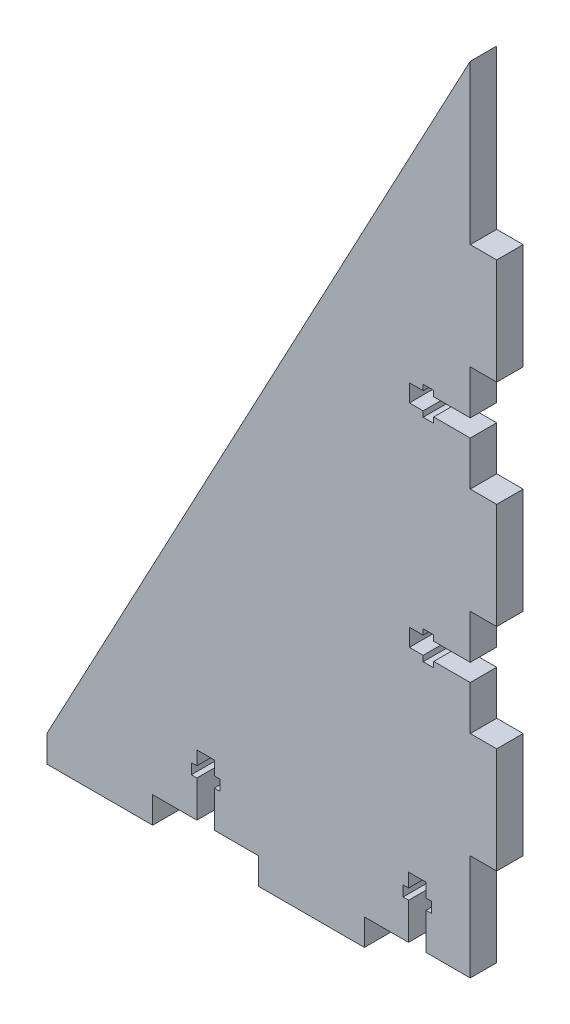
from build123d import *

# Parameters (mm, degrees)
BOSS_EXTRUDE1_DEPTH = 3.175
SKETCH2_W           = 6.35
SKETCH2_H           = 25.4
BOSS_EXTRUDE2_DEPTH = 6.35
LPATTERN1_COUNT     = 3
LPATTERN1_PITCH     = 50.8
SKETCH3_W           = 25.4
SKETCH3_H           = 6.35
BOSS_EXTRUDE3_DEPTH = 6.35
LPATTERN2_COUNT     = 2
LPATTERN2_PITCH     = 50.8
CUT_EXTRUDE1_DEPTH  = 292.166765647


with BuildPart() as part:
    # Sketch1 → Boss-Extrude1 (new, symmetric)
    with BuildSketch(Plane.XY):
        Polygon((49.19007938, 285.75), (49.19007938, 95.25), (-52.40992062, 95.25), align=None)
    extrude(amount=BOSS_EXTRUDE1_DEPTH, both=True)

    # Sketch2 → Boss-Extrude2 (add)
    with BuildSketch(Plane(origin=(49.19007938, 0, 0), x_dir=(0, 0, -1), z_dir=(1, 0, 0))):
        with Locations((0, 133.35)):
            Rectangle(SKETCH2_W, SKETCH2_H)
    boss_extrude2 = extrude(amount=BOSS_EXTRUDE2_DEPTH)

    # LPattern1: Boss-Extrude2 ×3
    with Locations(*[(0, i * LPATTERN1_PITCH, 0) for i in range(1, LPATTERN1_COUNT)]):
        add(boss_extrude2)

    # Sketch3 → Boss-Extrude3 (add)
    with BuildSketch(Plane.XZ.offset(-95.25)):
        with Locations((11.09007938, 0)):
            Rectangle(SKETCH3_W, SKETCH3_H)
    boss_extrude3 = extrude(amount=BOSS_EXTRUDE3_DEPTH)

    # LPattern2: Boss-Extrude3 ×2
    with Locations(*[(-i * LPATTERN2_PITCH, 0, 0) for i in range(1, LPATTERN2_COUNT)]):
        add(boss_extrude3)

    # Sketch4 → Cut-Extrude1 (cut, through all)
    with BuildSketch(Plane.XY.offset(3.175)):
        Polygon((49.19007938, 156.6545), (49.19007938, 160.8455), (40.42707938, 160.8455), (40.42707938, 162.179), (37.88707938, 162.179), (37.88707938, 160.8455), (34.58507938, 160.8455), (34.58507938, 156.6545), (37.88707938, 156.6545), (37.88707938, 155.321), (40.42707938, 155.321), (40.42707938, 156.6545), align=None)
        Polygon((-16.40542062, 95.25), (-12.21442062, 95.25), (-12.21442062, 104.013), (-10.88092062, 104.013), (-10.88092062, 106.553), (-12.21442062, 106.553), (-12.21442062, 109.855), (-16.40542062, 109.855), (-16.40542062, 106.553), (-17.73892062, 106.553), (-17.73892062, 104.013), (-16.40542062, 104.013), align=None)
        Polygon((49.19007938, 207.4545), (49.19007938, 211.6455), (40.42707938, 211.6455), (40.42707938, 212.979), (37.88707938, 212.979), (37.88707938, 211.6455), (34.58507938, 211.6455), (34.58507938, 207.4545), (37.88707938, 207.4545), (37.88707938, 206.121), (40.42707938, 206.121), (40.42707938, 207.4545), align=None)
        Polygon((34.39457938, 95.25), (38.58557938, 95.25), (38.58557938, 104.013), (39.91907938, 104.013), (39.91907938, 106.553), (38.58557938, 106.553), (38.58557938, 109.855), (34.39457938, 109.855), (34.39457938, 106.553), (33.06107938, 106.553), (33.06107938, 104.013), (34.39457938, 104.013), align=None)
    extrude(amount=-CUT_EXTRUDE1_DEPTH, mode=Mode.SUBTRACT)


solid = part.part
